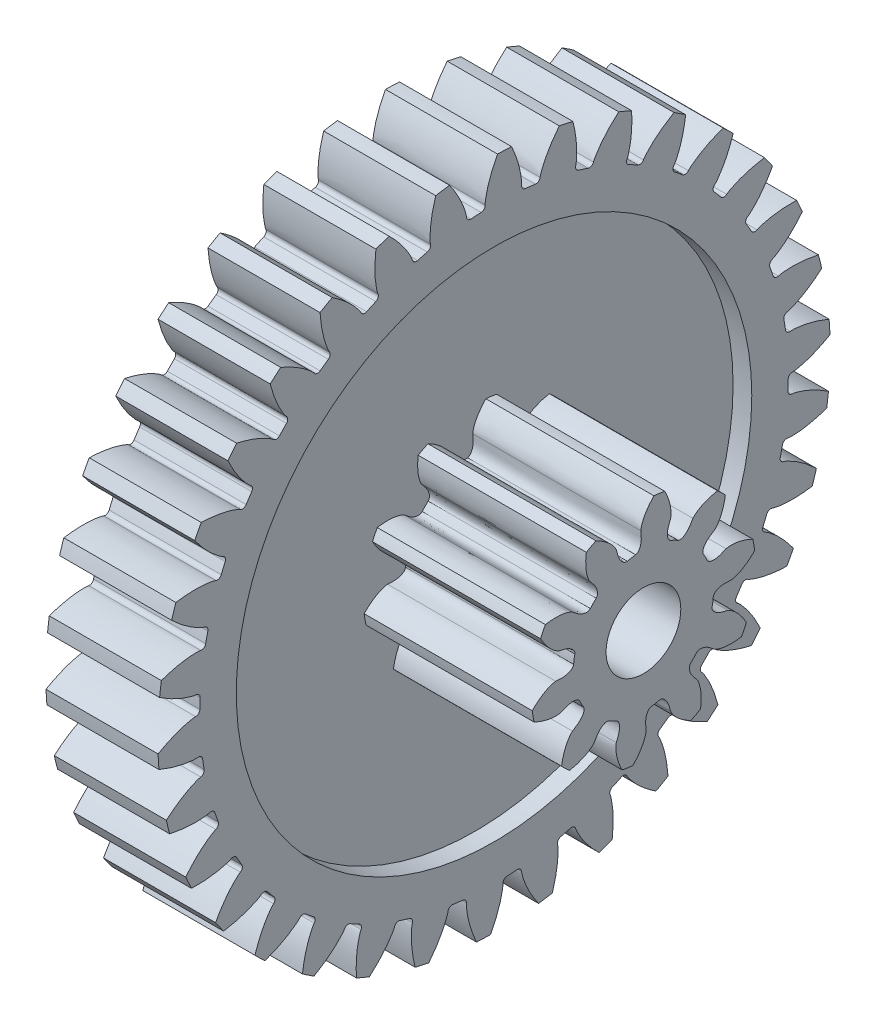
from build123d import *

# Parameters (mm, degrees)
ESQUISSE2_R             = 1
BOSS_EXTRU_1_DEPTH      = 3
ESQUISSE3_R             = 6.9
ENL_V_MAT_EXTRU_1_DEPTH = 0.5
ESQUISSE4_R             = 1
BOSS_EXTRU_2_DEPTH      = 4.5


with BuildPart() as part:
    # Esquisse2 → Boss.-Extru.1 (new body)
    with BuildSketch(Plane(origin=(0, 0, 0), x_dir=(0, 0, -1), z_dir=(1, 0, 0))):
        with BuildLine():
            ThreePointArc((8.992678526, 0.362950305), (8.983203595, 0.549593642), (8.969855294, 0.736000007))
            add(Edge.make_bspline(
                [(7.928017131, 0.973718567), (7.968735547, 0.978720051), (8.14599471, 0.972060465), (8.43210917, 0.923262044), (8.735368899, 0.829543111), (8.90576586, 0.762906571), (8.969855294, 0.736000007)],
                knots=[0, 0, 0, 0, 0.124841327, 0.52877899, 0.867841808, 1.076016146, 1.076016146, 1.076016146, 1.076016146], degree=3))
            ThreePointArc((7.928017131, 0.973718567), (7.845145349, 0.995861242), (7.801971612, 1.069983161))
            ThreePointArc((7.801971612, 1.069983161), (7.782401197, 1.204099918), (7.760525474, 1.337859996))
            ThreePointArc((7.760525474, 1.337859996), (7.7791127, 1.421320515), (7.851006147, 1.467607399))
            add(Edge.make_bspline(
                [(7.851006147, 1.467607399), (7.891911369, 1.47525391), (8.058869705, 1.535171146), (8.316858832, 1.668153777), (8.577616241, 1.849137964), (8.719907754, 1.964153953), (8.772869142, 2.009170729)],
                knots=[0, 0, 0, 0, 0.124841327, 0.52877899, 0.867841808, 1.076016146, 1.076016146, 1.076016146, 1.076016146], degree=3))
            ThreePointArc((8.772869142, 2.009170729), (8.729259916, 2.190895095), (8.681886815, 2.371674793))
            add(Edge.make_bspline(
                [(7.614107256, 2.413908484), (7.653213344, 2.426306797), (7.828678029, 2.452331888), (8.118887532, 2.456937748), (8.434204497, 2.420538386), (8.613944558, 2.38634682), (8.681886815, 2.371674793)],
                knots=[0, 0, 0, 0, 0.124841327, 0.52877899, 0.867841808, 1.076016146, 1.076016146, 1.076016146, 1.076016146], degree=3))
            ThreePointArc((7.614107256, 2.413908484), (7.528577818, 2.420446487), (7.472519329, 2.485373186))
            ThreePointArc((7.472519329, 2.485373186), (7.428638248, 2.613610296), (7.382556651, 2.741073201))
            ThreePointArc((7.382556651, 2.741073201), (7.385491564, 2.82652804), (7.447655696, 2.885237188))
            add(Edge.make_bspline(
                [(7.447655696, 2.885237188), (7.486459386, 2.900269817), (7.639565176, 2.989845363), (7.868726054, 3.167969089), (8.091787815, 3.393785724), (8.210522412, 3.532989345), (8.254310221, 3.586971254)],
                knots=[0, 0, 0, 0, 0.124841327, 0.52877899, 0.867841808, 1.076016146, 1.076016146, 1.076016146, 1.076016146], degree=3))
            ThreePointArc((8.254310221, 3.586971254), (8.17805176, 3.757588243), (8.098267094, 3.926585039))
            add(Edge.make_bspline(
                [(7.040908091, 3.771895641), (7.077070139, 3.791268575), (7.244765106, 3.849092091), (7.529186917, 3.906945383), (7.845823377, 3.92910513), (8.028785705, 3.928522889), (8.098267094, 3.926585039)],
                knots=[0, 0, 0, 0, 0.124841327, 0.52877899, 0.867841808, 1.076016146, 1.076016146, 1.076016146, 1.076016146], degree=3))
            ThreePointArc((7.040908091, 3.771895641), (6.955633599, 3.76260633), (6.888599363, 3.816126808))
            ThreePointArc((6.888599363, 3.816126808), (6.821901934, 3.93411731), (6.753183716, 4.050942446))
            ThreePointArc((6.753183716, 4.050942446), (6.740366371, 4.135481543), (6.790684263, 4.204613685))
            add(Edge.make_bspline(
                [(6.790684263, 4.204613685), (6.826065008, 4.226520515), (6.960104418, 4.342703981), (7.152633247, 4.559903013), (7.33040326, 4.822862182), (7.421537577, 4.981513022), (7.454660665, 5.042621775)],
                knots=[0, 0, 0, 0, 0.124841327, 0.52877899, 0.867841808, 1.076016146, 1.076016146, 1.076016146, 1.076016146], degree=3))
            ThreePointArc((7.454660665, 5.042621775), (7.34834986, 5.19632123), (7.2388706, 5.34778014))
            add(Edge.make_bspline(
                [(6.227939246, 5.001435417), (6.259925799, 5.027123248), (6.414140397, 5.114776078), (6.683088872, 5.223906679), (6.990262151, 5.303870911), (7.170216185, 5.336917824), (7.2388706, 5.34778014)],
                knots=[0, 0, 0, 0, 0.124841327, 0.52877899, 0.867841808, 1.076016146, 1.076016146, 1.076016146, 1.076016146], degree=3))
            ThreePointArc((6.227939246, 5.001435417), (6.14582362, 4.976635127), (6.070096408, 5.016926809))
            ThreePointArc((6.070096408, 5.016926809), (5.982853931, 5.120652678), (5.893839209, 5.222861704))
            ThreePointArc((5.893839209, 5.222861704), (5.865706085, 5.303606182), (5.902464222, 5.380807106))
            add(Edge.make_bspline(
                [(5.902464222, 5.380807106), (5.933217173, 5.408842125), (6.043625651, 5.547677024), (6.192966094, 5.79655491), (6.319390614, 6.087701853), (6.379821181, 6.260397247), (6.401151581, 6.32655186)],
                knots=[0, 0, 0, 0, 0.124841327, 0.52877899, 0.867841808, 1.076016146, 1.076016146, 1.076016146, 1.076016146], degree=3))
            ThreePointArc((6.401151581, 6.32655186), (6.268408719, 6.45809973), (6.13296305, 6.586863003))
            add(Edge.make_bspline(
                [(5.202885399, 6.060657308), (5.229607193, 6.091785269), (5.36508983, 6.206282501), (5.60940625, 6.362974098), (5.896655932, 6.498019729), (6.067473552, 6.563570423), (6.13296305, 6.586863003)],
                knots=[0, 0, 0, 0, 0.124841327, 0.52877899, 0.867841808, 1.076016146, 1.076016146, 1.076016146, 1.076016146], degree=3))
            ThreePointArc((5.202885399, 6.060657308), (5.126724989, 6.021190583), (5.044883599, 6.046881384))
            ThreePointArc((5.044883599, 6.046881384), (4.940067013, 6.13281036), (4.833787077, 6.216922671))
            ThreePointArc((4.833787077, 6.216922671), (4.791296214, 6.291122873), (4.813242841, 6.373763594))
            add(Edge.make_bspline(
                [(4.813242841, 6.373763594), (4.838320743, 6.406972104), (4.921338461, 6.563730579), (5.022404908, 6.835812081), (5.0931787, 7.145232139), (5.120847626, 7.326091153), (5.129658958, 7.395038808)],
                knots=[0, 0, 0, 0, 0.124841327, 0.52877899, 0.867841808, 1.076016146, 1.076016146, 1.076016146, 1.076016146], degree=3))
            ThreePointArc((5.129658958, 7.395038808), (4.975004437, 7.49995539), (4.818204799, 7.601638147))
            add(Edge.make_bspline(
                [(4.00065353, 6.913490784), (4.021200587, 6.948998848), (4.133337563, 7.086441417), (4.344702027, 7.285358066), (4.602246167, 7.470886279), (4.758110384, 7.566708503), (4.818204799, 7.601638147)],
                knots=[0, 0, 0, 0, 0.124841327, 0.52877899, 0.867841808, 1.076016146, 1.076016146, 1.076016146, 1.076016146], degree=3))
            ThreePointArc((4.00065353, 6.913490784), (3.933041887, 6.860701616), (3.84787333, 6.870916666))
            ThreePointArc((3.84787333, 6.870916666), (3.729052038, 6.936122541), (3.609126123, 6.999273793))
            ThreePointArc((3.609126123, 6.999273793), (3.553724497, 7.06440292), (3.560112248, 7.149669208))
            add(Edge.make_bspline(
                [(3.560112248, 7.149669208), (3.578661103, 7.186920332), (3.631460993, 7.356264162), (3.680811746, 7.64228387), (3.693524693, 7.959440113), (3.687489747, 8.142303811), (3.683481951, 8.21169658)],
                knots=[0, 0, 0, 0, 0.124841327, 0.52877899, 0.867841808, 1.076016146, 1.076016146, 1.076016146, 1.076016146], degree=3))
            ThreePointArc((3.683481951, 8.21169658), (3.512182346, 8.286409063), (3.339368362, 8.35754862))
            add(Edge.make_bspline(
                [(2.662184203, 7.530893622), (2.675856818, 7.569572607), (2.760829443, 7.72528007), (2.932044187, 7.959647903), (3.151112429, 8.189340757), (3.286715474, 8.3121714), (3.339368362, 8.35754862)],
                knots=[0, 0, 0, 0, 0.124841327, 0.52877899, 0.867841808, 1.076016146, 1.076016146, 1.076016146, 1.076016146], degree=3))
            ThreePointArc((2.662184203, 7.530893622), (2.605423761, 7.466579684), (2.51982835, 7.460971122))
            ThreePointArc((2.51982835, 7.460971122), (2.391048668, 7.503233388), (2.261560708, 7.543273041))
            ThreePointArc((2.261560708, 7.543273041), (2.195134954, 7.597113198), (2.185746302, 7.682101412))
            add(Edge.make_bspline(
                [(2.185746302, 7.682101412), (2.197134452, 7.722126608), (2.217918476, 7.898288992), (2.213872956, 8.188506848), (2.168092134, 8.502598901), (2.128558827, 8.681240079), (2.111868384, 8.748714873)],
                knots=[0, 0, 0, 0, 0.124841327, 0.52877899, 0.867841808, 1.076016146, 1.076016146, 1.076016146, 1.076016146], degree=3))
            ThreePointArc((2.111868384, 8.748714873), (1.929757098, 8.790679015), (1.74681374, 8.8288528))
            add(Edge.make_bspline(
                [(1.233057386, 7.891840911), (1.239389954, 7.932373648), (1.294304588, 8.101043575), (1.419539098, 8.362881478), (1.592671336, 8.628917058), (1.70339541, 8.77457327), (1.74681374, 8.8288528)],
                knots=[0, 0, 0, 0, 0.124841327, 0.52877899, 0.867841808, 1.076016146, 1.076016146, 1.076016146, 1.076016146], degree=3))
            ThreePointArc((1.233057386, 7.891840911), (1.189081054, 7.818192336), (1.105973638, 7.796951155))
            ThreePointArc((1.105973638, 7.796951155), (0.971621004, 7.81483062), (0.836980555, 7.830395172))
            ThreePointArc((0.836980555, 7.830395172), (0.761792723, 7.871112898), (0.736947387, 7.952928866))
            add(Edge.make_bspline(
                [(0.736947387, 7.952928866), (0.740787022, 7.994365125), (0.728847405, 8.171347063), (0.671543377, 8.455880046), (0.568827797, 8.756211882), (0.49714239, 8.924547128), (0.468337672, 8.987806174)],
                knots=[0, 0, 0, 0, 0.124841327, 0.52877899, 0.867841808, 1.076016146, 1.076016146, 1.076016146, 1.076016146], degree=3))
            ThreePointArc((0.468337672, 8.987806174), (0.281616286, 8.995592936), (0.094773472, 8.999500986))
            add(Edge.make_bspline(
                [(-0.238059721, 7.984041022), (-0.239282848, 8.02504722), (-0.216296258, 8.200935757), (-0.141306691, 8.481327153), (-0.020006268, 8.774645937), (0.062068259, 8.938167571), (0.094773472, 8.999500986)],
                knots=[0, 0, 0, 0, 0.124841327, 0.52877899, 0.867841808, 1.076016146, 1.076016146, 1.076016146, 1.076016146], degree=3))
            ThreePointArc((-0.238059721, 7.984041022), (-0.267754383, 7.903565825), (-0.34554368, 7.867415368))
            ThreePointArc((-0.34554368, 7.867415368), (-0.480894049, 7.860303169), (-0.616101967, 7.850862587))
            ThreePointArc((-0.616101967, 7.850862587), (-0.697491446, 7.877071289), (-0.736947387, 7.952928866))
            add(Edge.make_bspline(
                [(-0.736947387, 7.952928866), (-0.740787022, 7.994365125), (-0.78504369, 8.166139711), (-0.893654807, 8.435298391), (-1.049807289, 8.711642568), (-1.151203635, 8.863939428), (-1.191141718, 8.920828516)],
                knots=[0, 0, 0, 0, 0.124841327, 0.52877899, 0.867841808, 1.076016146, 1.076016146, 1.076016146, 1.076016146], degree=3))
            ThreePointArc((-1.191141718, 8.920828516), (-1.376114631, 8.894172728), (-1.560494193, 8.863681959))
            add(Edge.make_bspline(
                [(-1.70106999, 7.804354193), (-1.70980716, 7.844437433), (-1.719531394, 8.021554909), (-1.697340451, 8.310951405), (-1.632002584, 8.621564774), (-1.581372552, 8.797383295), (-1.560494193, 8.863681959)],
                knots=[0, 0, 0, 0, 0.124841327, 0.52877899, 0.867841808, 1.076016146, 1.076016146, 1.076016146, 1.076016146], degree=3))
            ThreePointArc((-1.70106999, 7.804354193), (-1.715471765, 7.719792859), (-1.785293922, 7.669964186))
            ThreePointArc((-1.785293922, 7.669964186), (-1.917032831, 7.638102521), (-2.048203875, 7.603978293))
            ThreePointArc((-2.048203875, 7.603978293), (-2.13302338, 7.614785465), (-2.185746302, 7.682101412))
            add(Edge.make_bspline(
                [(-2.185746302, 7.682101412), (-2.197134452, 7.722126608), (-2.272201064, 7.882844264), (-2.428420647, 8.127462766), (-2.632692446, 8.370408715), (-2.760346802, 8.501480902), (-2.810058205, 8.550062742)],
                knots=[0, 0, 0, 0, 0.124841327, 0.52877899, 0.867841808, 1.076016146, 1.076016146, 1.076016146, 1.076016146], degree=3))
            ThreePointArc((-2.810058205, 8.550062742), (-2.986983615, 8.489872136), (-3.1626211, 8.426020875))
            add(Edge.make_bspline(
                [(-3.106152361, 7.358899441), (-3.12210604, 7.396694737), (-3.164209951, 7.569009628), (-3.195573318, 7.857556174), (-3.188423008, 8.174886562), (-3.170961618, 8.357014683), (-3.1626211, 8.426020875)],
                knots=[0, 0, 0, 0, 0.124841327, 0.52877899, 0.867841808, 1.076016146, 1.076016146, 1.076016146, 1.076016146], degree=3))
            ThreePointArc((-3.106152361, 7.358899441), (-3.104770813, 7.273131606), (-3.164248122, 7.211321573))
            ThreePointArc((-3.164248122, 7.211321573), (-3.287889359, 7.155795453), (-3.410556657, 7.098149639))
            ThreePointArc((-3.410556657, 7.098149639), (-3.49591776, 7.093187254), (-3.560112248, 7.149669208))
            add(Edge.make_bspline(
                [(-3.560112248, 7.149669208), (-3.578661103, 7.186920332), (-3.681981355, 7.331108011), (-3.880489536, 7.542856145), (-4.125924419, 7.744130633), (-4.275489668, 7.84951464), (-4.33328153, 7.888134836)],
                knots=[0, 0, 0, 0, 0.124841327, 0.52877899, 0.867841808, 1.076016146, 1.076016146, 1.076016146, 1.076016146], degree=3))
            ThreePointArc((-4.33328153, 7.888134836), (-4.496134454, 7.79645913), (-4.657048739, 7.701421755))
            add(Edge.make_bspline(
                [(-4.405458438, 6.662846196), (-4.428085343, 6.697066474), (-4.501135134, 6.858710803), (-4.584984768, 7.136581292), (-4.636265512, 7.449822393), (-4.652567389, 7.632057959), (-4.657048739, 7.701421755)],
                knots=[0, 0, 0, 0, 0.124841327, 0.52877899, 0.867841808, 1.076016146, 1.076016146, 1.076016146, 1.076016146], degree=3))
            ThreePointArc((-4.405458438, 6.662846196), (-4.388340616, 6.578792579), (-4.435447646, 6.507106053))
            ThreePointArc((-4.435447646, 6.507106053), (-4.546780759, 6.429806352), (-4.656767022, 6.350602011))
            ThreePointArc((-4.656767022, 6.350602011), (-4.739762855, 6.330039059), (-4.813242841, 6.373763594))
            add(Edge.make_bspline(
                [(-4.813242841, 6.373763594), (-4.838320743, 6.406972104), (-4.966376188, 6.529719667), (-5.200413007, 6.701386604), (-5.478652985, 6.85413547), (-5.645035862, 6.930242572), (-5.70894015, 6.957585958)],
                knots=[0, 0, 0, 0, 0.124841327, 0.52877899, 0.867841808, 1.076016146, 1.076016146, 1.076016146, 1.076016146], degree=3))
            ThreePointArc((-5.70894015, 6.957585958), (-5.852174827, 6.83754706), (-5.992886168, 6.714559954))
            add(Edge.make_bspline(
                [(-5.554741912, 5.739897714), (-5.58327151, 5.769377644), (-5.684779557, 5.914846807), (-5.81826006, 6.172578694), (-5.926225553, 6.471063457), (-5.975735558, 6.647200654), (-5.992886168, 6.714559954)],
                knots=[0, 0, 0, 0, 0.124841327, 0.52877899, 0.867841808, 1.076016146, 1.076016146, 1.076016146, 1.076016146], degree=3))
            ThreePointArc((-5.554741912, 5.739897714), (-5.522470742, 5.660420661), (-5.555603321, 5.58129884))
            ThreePointArc((-5.555603321, 5.58129884), (-5.650836993, 5.484857908), (-5.744396771, 5.386792249))
            ThreePointArc((-5.744396771, 5.386792249), (-5.82220101, 5.351328976), (-5.902464222, 5.380807106))
            add(Edge.make_bspline(
                [(-5.902464222, 5.380807106), (-5.933217173, 5.408842125), (-6.081647036, 5.505969552), (-6.34324265, 5.63170938), (-6.644812595, 5.730730945), (-6.82234713, 5.774969405), (-6.89018766, 5.790104836)],
                knots=[0, 0, 0, 0, 0.124841327, 0.52877899, 0.867841808, 1.076016146, 1.076016146, 1.076016146, 1.076016146], degree=3))
            ThreePointArc((-6.89018766, 5.790104836), (-7.008926405, 5.645790525), (-7.124643046, 5.499041868))
            add(Edge.make_bspline(
                [(-6.514865313, 4.6214839), (-6.548326063, 4.645219578), (-6.674835631, 4.769559798), (-6.853401485, 4.998376331), (-7.014375092, 5.271940217), (-7.095407219, 5.435980904), (-7.124643046, 5.499041868)],
                knots=[0, 0, 0, 0, 0.124841327, 0.52877899, 0.867841808, 1.076016146, 1.076016146, 1.076016146, 1.076016146], degree=3))
            ThreePointArc((-6.514865313, 4.6214839), (-6.46853975, 4.549289907), (-6.486569587, 4.46542719))
            ThreePointArc((-6.486569587, 4.46542719), (-6.562460751, 4.353129207), (-6.636407979, 4.239541737))
            ThreePointArc((-6.636407979, 4.239541737), (-6.706371093, 4.190385802), (-6.790684263, 4.204613685))
            add(Edge.make_bspline(
                [(-6.790684263, 4.204613685), (-6.826065008, 4.226520515), (-6.989814688, 4.294720246), (-7.270060773, 4.370251048), (-7.584691081, 4.41217325), (-7.767331549, 4.423036581), (-7.836798093, 4.425448638)],
                knots=[0, 0, 0, 0, 0.124841327, 0.52877899, 0.867841808, 1.076016146, 1.076016146, 1.076016146, 1.076016146], degree=3))
            ThreePointArc((-7.836798093, 4.425448638), (-7.9269974, 4.261773366), (-8.013778751, 4.096260505))
            add(Edge.make_bspline(
                [(-7.253132789, 3.345690994), (-7.290385226, 3.362874131), (-7.437588183, 3.46185115), (-7.655158542, 3.653960257), (-7.863658499, 3.893287376), (-7.973453297, 4.039645344), (-8.013778751, 4.096260505)],
                knots=[0, 0, 0, 0, 0.124841327, 0.52877899, 0.867841808, 1.076016146, 1.076016146, 1.076016146, 1.076016146], degree=3))
            ThreePointArc((-7.253132789, 3.345690994), (-7.194330395, 3.283238541), (-7.196643507, 3.197490772))
            ThreePointArc((-7.196643507, 3.197490772), (-7.250607779, 3.073159911), (-7.302424271, 2.947918717))
            ThreePointArc((-7.302424271, 2.947918717), (-7.362163751, 2.886744066), (-7.447655696, 2.885237188))
            add(Edge.make_bspline(
                [(-7.447655696, 2.885237188), (-7.486459386, 2.900269817), (-7.659952585, 2.937219394), (-7.949305695, 2.959969057), (-8.266282009, 2.943364287), (-8.447808808, 2.920482551), (-8.516535767, 2.910089094)],
                knots=[0, 0, 0, 0, 0.124841327, 0.52877899, 0.867841808, 1.076016146, 1.076016146, 1.076016146, 1.076016146], degree=3))
            ThreePointArc((-8.516535767, 2.910089094), (-8.575124006, 2.732626625), (-8.630014832, 2.553985905))
            add(Edge.make_bspline(
                [(-7.744403527, 1.955964595), (-7.784179063, 1.966010038), (-7.94706259, 2.036253313), (-8.196228356, 2.185112949), (-8.445154448, 2.382053302), (-8.579972987, 2.505744507), (-8.630014832, 2.553985905)],
                knots=[0, 0, 0, 0, 0.124841327, 0.52877899, 0.867841808, 1.076016146, 1.076016146, 1.076016146, 1.076016146], degree=3))
            ThreePointArc((-7.744403527, 1.955964595), (-7.675126748, 1.905380425), (-7.661644363, 1.820667641))
            ThreePointArc((-7.661644363, 1.820667641), (-7.691844055, 1.68853784), (-7.719765264, 1.55590786))
            ThreePointArc((-7.719765264, 1.55590786), (-7.767246753, 1.484797724), (-7.851006147, 1.467607399))
            add(Edge.make_bspline(
                [(-7.851006147, 1.467607399), (-7.891911369, 1.47525391), (-8.069239983, 1.479695059), (-8.357846547, 1.448888871), (-8.666374618, 1.374322583), (-8.84060607, 1.318474991), (-8.906253029, 1.295629957)],
                knots=[0, 0, 0, 0, 0.124841327, 0.52877899, 0.867841808, 1.076016146, 1.076016146, 1.076016146, 1.076016146], degree=3))
            ThreePointArc((-8.906253029, 1.295629957), (-8.93123505, 1.110423563), (-8.952366108, 0.924738377))
            add(Edge.make_bspline(
                [(-7.971947891, 0.499630167), (-8.012892019, 0.502195832), (-8.185909312, 0.541313312), (-8.458185443, 0.641854241), (-8.73906079, 0.78970126), (-8.894311987, 0.886513545), (-8.952366108, 0.924738377)],
                knots=[0, 0, 0, 0, 0.124841327, 0.52877899, 0.867841808, 1.076016146, 1.076016146, 1.076016146, 1.076016146], degree=3))
            ThreePointArc((-7.971947891, 0.499630167), (-7.894555864, 0.462636863), (-7.865737109, 0.381843858))
            ThreePointArc((-7.865737109, 0.381843858), (-7.871143807, 0.246414639), (-7.874218909, 0.110912427))
            ThreePointArc((-7.874218909, 0.110912427), (-7.907825483, 0.032288375), (-7.987, 0))
            add(Edge.make_bspline(
                [(-7.987, 0), (-8.028613776, 0), (-8.203739092, -0.028218518), (-8.481770958, -0.111531489), (-8.771344233, -0.241520028), (-8.932347096, -0.328431654), (-8.992678526, -0.362950305)],
                knots=[0, 0, 0, 0, 0.124841327, 0.52877899, 0.867841808, 1.076016146, 1.076016146, 1.076016146, 1.076016146], degree=3))
            ThreePointArc((-8.992678526, -0.362950305), (-8.983203595, -0.549593642), (-8.969855294, -0.736000007))
            add(Edge.make_bspline(
                [(-7.928017131, -0.973718567), (-7.968735547, -0.978720051), (-8.14599471, -0.972060465), (-8.43210917, -0.923262044), (-8.735368899, -0.829543111), (-8.90576586, -0.762906571), (-8.969855294, -0.736000007)],
                knots=[0, 0, 0, 0, 0.124841327, 0.52877899, 0.867841808, 1.076016146, 1.076016146, 1.076016146, 1.076016146], degree=3))
            ThreePointArc((-7.928017131, -0.973718567), (-7.845145349, -0.995861242), (-7.801971612, -1.069983161))
            ThreePointArc((-7.801971612, -1.069983161), (-7.782401197, -1.204099918), (-7.760525474, -1.337859996))
            ThreePointArc((-7.760525474, -1.337859996), (-7.7791127, -1.421320515), (-7.851006147, -1.467607399))
            add(Edge.make_bspline(
                [(-7.851006147, -1.467607399), (-7.891911369, -1.47525391), (-8.058869705, -1.535171146), (-8.316858832, -1.668153777), (-8.577616241, -1.849137964), (-8.719907754, -1.964153953), (-8.772869142, -2.009170729)],
                knots=[0, 0, 0, 0, 0.124841327, 0.52877899, 0.867841808, 1.076016146, 1.076016146, 1.076016146, 1.076016146], degree=3))
            ThreePointArc((-8.772869142, -2.009170729), (-8.729259916, -2.190895095), (-8.681886815, -2.371674793))
            add(Edge.make_bspline(
                [(-7.614107256, -2.413908484), (-7.653213344, -2.426306797), (-7.828678029, -2.452331888), (-8.118887532, -2.456937748), (-8.434204497, -2.420538386), (-8.613944558, -2.38634682), (-8.681886815, -2.371674793)],
                knots=[0, 0, 0, 0, 0.124841327, 0.52877899, 0.867841808, 1.076016146, 1.076016146, 1.076016146, 1.076016146], degree=3))
            ThreePointArc((-7.614107256, -2.413908484), (-7.528577818, -2.420446487), (-7.472519329, -2.485373186))
            ThreePointArc((-7.472519329, -2.485373186), (-7.428638248, -2.613610296), (-7.382556651, -2.741073201))
            ThreePointArc((-7.382556651, -2.741073201), (-7.385491564, -2.82652804), (-7.447655696, -2.885237188))
            add(Edge.make_bspline(
                [(-7.447655696, -2.885237188), (-7.486459386, -2.900269817), (-7.639565176, -2.989845363), (-7.868726054, -3.167969089), (-8.091787815, -3.393785724), (-8.210522412, -3.532989345), (-8.254310221, -3.586971254)],
                knots=[0, 0, 0, 0, 0.124841327, 0.52877899, 0.867841808, 1.076016146, 1.076016146, 1.076016146, 1.076016146], degree=3))
            ThreePointArc((-8.254310221, -3.586971254), (-8.17805176, -3.757588243), (-8.098267094, -3.926585039))
            add(Edge.make_bspline(
                [(-7.040908091, -3.771895641), (-7.077070139, -3.791268575), (-7.244765106, -3.849092091), (-7.529186917, -3.906945383), (-7.845823377, -3.92910513), (-8.028785705, -3.928522889), (-8.098267094, -3.926585039)],
                knots=[0, 0, 0, 0, 0.124841327, 0.52877899, 0.867841808, 1.076016146, 1.076016146, 1.076016146, 1.076016146], degree=3))
            ThreePointArc((-7.040908091, -3.771895641), (-6.955633599, -3.76260633), (-6.888599363, -3.816126808))
            ThreePointArc((-6.888599363, -3.816126808), (-6.821901934, -3.93411731), (-6.753183716, -4.050942446))
            ThreePointArc((-6.753183716, -4.050942446), (-6.740366371, -4.135481543), (-6.790684263, -4.204613685))
            add(Edge.make_bspline(
                [(-6.790684263, -4.204613685), (-6.826065008, -4.226520515), (-6.960104418, -4.342703981), (-7.152633247, -4.559903013), (-7.33040326, -4.822862182), (-7.421537577, -4.981513022), (-7.454660665, -5.042621775)],
                knots=[0, 0, 0, 0, 0.124841327, 0.52877899, 0.867841808, 1.076016146, 1.076016146, 1.076016146, 1.076016146], degree=3))
            ThreePointArc((-7.454660665, -5.042621775), (-7.34834986, -5.19632123), (-7.2388706, -5.34778014))
            add(Edge.make_bspline(
                [(-6.227939246, -5.001435417), (-6.259925799, -5.027123248), (-6.414140397, -5.114776078), (-6.683088872, -5.223906679), (-6.990262151, -5.303870911), (-7.170216185, -5.336917824), (-7.2388706, -5.34778014)],
                knots=[0, 0, 0, 0, 0.124841327, 0.52877899, 0.867841808, 1.076016146, 1.076016146, 1.076016146, 1.076016146], degree=3))
            ThreePointArc((-6.227939246, -5.001435417), (-6.14582362, -4.976635127), (-6.070096408, -5.016926809))
            ThreePointArc((-6.070096408, -5.016926809), (-5.982853931, -5.120652678), (-5.893839209, -5.222861704))
            ThreePointArc((-5.893839209, -5.222861704), (-5.865706085, -5.303606182), (-5.902464222, -5.380807106))
            add(Edge.make_bspline(
                [(-5.902464222, -5.380807106), (-5.933217173, -5.408842125), (-6.043625651, -5.547677024), (-6.192966094, -5.79655491), (-6.319390614, -6.087701853), (-6.379821181, -6.260397247), (-6.401151581, -6.32655186)],
                knots=[0, 0, 0, 0, 0.124841327, 0.52877899, 0.867841808, 1.076016146, 1.076016146, 1.076016146, 1.076016146], degree=3))
            ThreePointArc((-6.401151581, -6.32655186), (-6.268408719, -6.45809973), (-6.13296305, -6.586863003))
            add(Edge.make_bspline(
                [(-5.202885399, -6.060657308), (-5.229607193, -6.091785269), (-5.36508983, -6.206282501), (-5.60940625, -6.362974098), (-5.896655932, -6.498019729), (-6.067473552, -6.563570423), (-6.13296305, -6.586863003)],
                knots=[0, 0, 0, 0, 0.124841327, 0.52877899, 0.867841808, 1.076016146, 1.076016146, 1.076016146, 1.076016146], degree=3))
            ThreePointArc((-5.202885399, -6.060657308), (-5.126724989, -6.021190583), (-5.044883599, -6.046881384))
            ThreePointArc((-5.044883599, -6.046881384), (-4.940067013, -6.13281036), (-4.833787077, -6.216922671))
            ThreePointArc((-4.833787077, -6.216922671), (-4.791296214, -6.291122873), (-4.813242841, -6.373763594))
            add(Edge.make_bspline(
                [(-4.813242841, -6.373763594), (-4.838320743, -6.406972104), (-4.921338461, -6.563730579), (-5.022404908, -6.835812081), (-5.0931787, -7.145232139), (-5.120847626, -7.326091153), (-5.129658958, -7.395038808)],
                knots=[0, 0, 0, 0, 0.124841327, 0.52877899, 0.867841808, 1.076016146, 1.076016146, 1.076016146, 1.076016146], degree=3))
            ThreePointArc((-5.129658958, -7.395038808), (-4.975004437, -7.49995539), (-4.818204799, -7.601638147))
            add(Edge.make_bspline(
                [(-4.00065353, -6.913490784), (-4.021200587, -6.948998848), (-4.133337563, -7.086441417), (-4.344702027, -7.285358066), (-4.602246167, -7.470886279), (-4.758110384, -7.566708503), (-4.818204799, -7.601638147)],
                knots=[0, 0, 0, 0, 0.124841327, 0.52877899, 0.867841808, 1.076016146, 1.076016146, 1.076016146, 1.076016146], degree=3))
            ThreePointArc((-4.00065353, -6.913490784), (-3.933041887, -6.860701616), (-3.84787333, -6.870916666))
            ThreePointArc((-3.84787333, -6.870916666), (-3.729052038, -6.936122541), (-3.609126123, -6.999273793))
            ThreePointArc((-3.609126123, -6.999273793), (-3.553724497, -7.06440292), (-3.560112248, -7.149669208))
            add(Edge.make_bspline(
                [(-3.560112248, -7.149669208), (-3.578661103, -7.186920332), (-3.631460993, -7.356264162), (-3.680811746, -7.64228387), (-3.693524693, -7.959440113), (-3.687489747, -8.142303811), (-3.683481951, -8.21169658)],
                knots=[0, 0, 0, 0, 0.124841327, 0.52877899, 0.867841808, 1.076016146, 1.076016146, 1.076016146, 1.076016146], degree=3))
            ThreePointArc((-3.683481951, -8.21169658), (-3.512182346, -8.286409063), (-3.339368362, -8.35754862))
            add(Edge.make_bspline(
                [(-2.662184203, -7.530893622), (-2.675856818, -7.569572607), (-2.760829443, -7.72528007), (-2.932044187, -7.959647903), (-3.151112429, -8.189340757), (-3.286715474, -8.3121714), (-3.339368362, -8.35754862)],
                knots=[0, 0, 0, 0, 0.124841327, 0.52877899, 0.867841808, 1.076016146, 1.076016146, 1.076016146, 1.076016146], degree=3))
            ThreePointArc((-2.662184203, -7.530893622), (-2.605423761, -7.466579684), (-2.51982835, -7.460971122))
            ThreePointArc((-2.51982835, -7.460971122), (-2.391048668, -7.503233388), (-2.261560708, -7.543273041))
            ThreePointArc((-2.261560708, -7.543273041), (-2.195134954, -7.597113198), (-2.185746302, -7.682101412))
            add(Edge.make_bspline(
                [(-2.185746302, -7.682101412), (-2.197134452, -7.722126608), (-2.217918476, -7.898288992), (-2.213872956, -8.188506848), (-2.168092134, -8.502598901), (-2.128558827, -8.681240079), (-2.111868384, -8.748714873)],
                knots=[0, 0, 0, 0, 0.124841327, 0.52877899, 0.867841808, 1.076016146, 1.076016146, 1.076016146, 1.076016146], degree=3))
            ThreePointArc((-2.111868384, -8.748714873), (-1.929757098, -8.790679015), (-1.74681374, -8.8288528))
            add(Edge.make_bspline(
                [(-1.233057386, -7.891840911), (-1.239389954, -7.932373648), (-1.294304588, -8.101043575), (-1.419539098, -8.362881478), (-1.592671336, -8.628917058), (-1.70339541, -8.77457327), (-1.74681374, -8.8288528)],
                knots=[0, 0, 0, 0, 0.124841327, 0.52877899, 0.867841808, 1.076016146, 1.076016146, 1.076016146, 1.076016146], degree=3))
            ThreePointArc((-1.233057386, -7.891840911), (-1.189081054, -7.818192336), (-1.105973638, -7.796951155))
            ThreePointArc((-1.105973638, -7.796951155), (-0.971621004, -7.81483062), (-0.836980555, -7.830395172))
            ThreePointArc((-0.836980555, -7.830395172), (-0.761792723, -7.871112898), (-0.736947387, -7.952928866))
            add(Edge.make_bspline(
                [(-0.736947387, -7.952928866), (-0.740787022, -7.994365125), (-0.728847405, -8.171347063), (-0.671543377, -8.455880046), (-0.568827797, -8.756211882), (-0.49714239, -8.924547128), (-0.468337672, -8.987806174)],
                knots=[0, 0, 0, 0, 0.124841327, 0.52877899, 0.867841808, 1.076016146, 1.076016146, 1.076016146, 1.076016146], degree=3))
            ThreePointArc((-0.468337672, -8.987806174), (-0.281616286, -8.995592936), (-0.094773472, -8.999500986))
            add(Edge.make_bspline(
                [(0.238059721, -7.984041022), (0.239282848, -8.02504722), (0.216296258, -8.200935757), (0.141306691, -8.481327153), (0.020006268, -8.774645937), (-0.062068259, -8.938167571), (-0.094773472, -8.999500986)],
                knots=[0, 0, 0, 0, 0.124841327, 0.52877899, 0.867841808, 1.076016146, 1.076016146, 1.076016146, 1.076016146], degree=3))
            ThreePointArc((0.238059721, -7.984041022), (0.267754383, -7.903565825), (0.34554368, -7.867415368))
            ThreePointArc((0.34554368, -7.867415368), (0.480894049, -7.860303169), (0.616101967, -7.850862587))
            ThreePointArc((0.616101967, -7.850862587), (0.697491446, -7.877071289), (0.736947387, -7.952928866))
            add(Edge.make_bspline(
                [(0.736947387, -7.952928866), (0.740787022, -7.994365125), (0.78504369, -8.166139711), (0.893654807, -8.435298391), (1.049807289, -8.711642568), (1.151203635, -8.863939428), (1.191141718, -8.920828516)],
                knots=[0, 0, 0, 0, 0.124841327, 0.52877899, 0.867841808, 1.076016146, 1.076016146, 1.076016146, 1.076016146], degree=3))
            ThreePointArc((1.191141718, -8.920828516), (1.376114631, -8.894172728), (1.560494193, -8.863681959))
            add(Edge.make_bspline(
                [(1.70106999, -7.804354193), (1.70980716, -7.844437433), (1.719531394, -8.021554909), (1.697340451, -8.310951405), (1.632002584, -8.621564774), (1.581372552, -8.797383295), (1.560494193, -8.863681959)],
                knots=[0, 0, 0, 0, 0.124841327, 0.52877899, 0.867841808, 1.076016146, 1.076016146, 1.076016146, 1.076016146], degree=3))
            ThreePointArc((1.70106999, -7.804354193), (1.715471765, -7.719792859), (1.785293922, -7.669964186))
            ThreePointArc((1.785293922, -7.669964186), (1.917032831, -7.638102521), (2.048203875, -7.603978293))
            ThreePointArc((2.048203875, -7.603978293), (2.13302338, -7.614785465), (2.185746302, -7.682101412))
            add(Edge.make_bspline(
                [(2.185746302, -7.682101412), (2.197134452, -7.722126608), (2.272201064, -7.882844264), (2.428420647, -8.127462766), (2.632692446, -8.370408715), (2.760346802, -8.501480902), (2.810058205, -8.550062742)],
                knots=[0, 0, 0, 0, 0.124841327, 0.52877899, 0.867841808, 1.076016146, 1.076016146, 1.076016146, 1.076016146], degree=3))
            ThreePointArc((2.810058205, -8.550062742), (2.986983615, -8.489872136), (3.1626211, -8.426020875))
            add(Edge.make_bspline(
                [(3.106152361, -7.358899441), (3.12210604, -7.396694737), (3.164209951, -7.569009628), (3.195573318, -7.857556174), (3.188423008, -8.174886562), (3.170961618, -8.357014683), (3.1626211, -8.426020875)],
                knots=[0, 0, 0, 0, 0.124841327, 0.52877899, 0.867841808, 1.076016146, 1.076016146, 1.076016146, 1.076016146], degree=3))
            ThreePointArc((3.106152361, -7.358899441), (3.104770813, -7.273131606), (3.164248122, -7.211321573))
            ThreePointArc((3.164248122, -7.211321573), (3.287889359, -7.155795453), (3.410556657, -7.098149639))
            ThreePointArc((3.410556657, -7.098149639), (3.49591776, -7.093187254), (3.560112248, -7.149669208))
            add(Edge.make_bspline(
                [(3.560112248, -7.149669208), (3.578661103, -7.186920332), (3.681981355, -7.331108011), (3.880489536, -7.542856145), (4.125924419, -7.744130633), (4.275489668, -7.84951464), (4.33328153, -7.888134836)],
                knots=[0, 0, 0, 0, 0.124841327, 0.52877899, 0.867841808, 1.076016146, 1.076016146, 1.076016146, 1.076016146], degree=3))
            ThreePointArc((4.33328153, -7.888134836), (4.496134454, -7.79645913), (4.657048739, -7.701421755))
            add(Edge.make_bspline(
                [(4.405458438, -6.662846196), (4.428085343, -6.697066474), (4.501135134, -6.858710803), (4.584984768, -7.136581292), (4.636265512, -7.449822393), (4.652567389, -7.632057959), (4.657048739, -7.701421755)],
                knots=[0, 0, 0, 0, 0.124841327, 0.52877899, 0.867841808, 1.076016146, 1.076016146, 1.076016146, 1.076016146], degree=3))
            ThreePointArc((4.405458438, -6.662846196), (4.388340616, -6.578792579), (4.435447646, -6.507106053))
            ThreePointArc((4.435447646, -6.507106053), (4.546780759, -6.429806352), (4.656767022, -6.350602011))
            ThreePointArc((4.656767022, -6.350602011), (4.739762855, -6.330039059), (4.813242841, -6.373763594))
            add(Edge.make_bspline(
                [(4.813242841, -6.373763594), (4.838320743, -6.406972104), (4.966376188, -6.529719667), (5.200413007, -6.701386604), (5.478652985, -6.85413547), (5.645035862, -6.930242572), (5.70894015, -6.957585958)],
                knots=[0, 0, 0, 0, 0.124841327, 0.52877899, 0.867841808, 1.076016146, 1.076016146, 1.076016146, 1.076016146], degree=3))
            ThreePointArc((5.70894015, -6.957585958), (5.852174827, -6.83754706), (5.992886168, -6.714559954))
            add(Edge.make_bspline(
                [(5.554741912, -5.739897714), (5.58327151, -5.769377644), (5.684779557, -5.914846807), (5.81826006, -6.172578694), (5.926225553, -6.471063457), (5.975735558, -6.647200654), (5.992886168, -6.714559954)],
                knots=[0, 0, 0, 0, 0.124841327, 0.52877899, 0.867841808, 1.076016146, 1.076016146, 1.076016146, 1.076016146], degree=3))
            ThreePointArc((5.554741912, -5.739897714), (5.522470742, -5.660420661), (5.555603321, -5.58129884))
            ThreePointArc((5.555603321, -5.58129884), (5.650836993, -5.484857908), (5.744396771, -5.386792249))
            ThreePointArc((5.744396771, -5.386792249), (5.82220101, -5.351328976), (5.902464222, -5.380807106))
            add(Edge.make_bspline(
                [(5.902464222, -5.380807106), (5.933217173, -5.408842125), (6.081647036, -5.505969552), (6.34324265, -5.63170938), (6.644812595, -5.730730945), (6.82234713, -5.774969405), (6.89018766, -5.790104836)],
                knots=[0, 0, 0, 0, 0.124841327, 0.52877899, 0.867841808, 1.076016146, 1.076016146, 1.076016146, 1.076016146], degree=3))
            ThreePointArc((6.89018766, -5.790104836), (7.008926405, -5.645790525), (7.124643046, -5.499041868))
            add(Edge.make_bspline(
                [(6.514865313, -4.6214839), (6.548326063, -4.645219578), (6.674835631, -4.769559798), (6.853401485, -4.998376331), (7.014375092, -5.271940217), (7.095407219, -5.435980904), (7.124643046, -5.499041868)],
                knots=[0, 0, 0, 0, 0.124841327, 0.52877899, 0.867841808, 1.076016146, 1.076016146, 1.076016146, 1.076016146], degree=3))
            ThreePointArc((6.514865313, -4.6214839), (6.46853975, -4.549289907), (6.486569587, -4.46542719))
            ThreePointArc((6.486569587, -4.46542719), (6.562460751, -4.353129207), (6.636407979, -4.239541737))
            ThreePointArc((6.636407979, -4.239541737), (6.706371093, -4.190385802), (6.790684263, -4.204613685))
            add(Edge.make_bspline(
                [(6.790684263, -4.204613685), (6.826065008, -4.226520515), (6.989814688, -4.294720246), (7.270060773, -4.370251048), (7.584691081, -4.41217325), (7.767331549, -4.423036581), (7.836798093, -4.425448638)],
                knots=[0, 0, 0, 0, 0.124841327, 0.52877899, 0.867841808, 1.076016146, 1.076016146, 1.076016146, 1.076016146], degree=3))
            ThreePointArc((7.836798093, -4.425448638), (7.9269974, -4.261773366), (8.013778751, -4.096260505))
            add(Edge.make_bspline(
                [(7.253132789, -3.345690994), (7.290385226, -3.362874131), (7.437588183, -3.46185115), (7.655158542, -3.653960257), (7.863658499, -3.893287376), (7.973453297, -4.039645344), (8.013778751, -4.096260505)],
                knots=[0, 0, 0, 0, 0.124841327, 0.52877899, 0.867841808, 1.076016146, 1.076016146, 1.076016146, 1.076016146], degree=3))
            ThreePointArc((7.253132789, -3.345690994), (7.194330395, -3.283238541), (7.196643507, -3.197490772))
            ThreePointArc((7.196643507, -3.197490772), (7.250607779, -3.073159911), (7.302424271, -2.947918717))
            ThreePointArc((7.302424271, -2.947918717), (7.362163751, -2.886744066), (7.447655696, -2.885237188))
            add(Edge.make_bspline(
                [(7.447655696, -2.885237188), (7.486459386, -2.900269817), (7.659952585, -2.937219394), (7.949305695, -2.959969057), (8.266282009, -2.943364287), (8.447808808, -2.920482551), (8.516535767, -2.910089094)],
                knots=[0, 0, 0, 0, 0.124841327, 0.52877899, 0.867841808, 1.076016146, 1.076016146, 1.076016146, 1.076016146], degree=3))
            ThreePointArc((8.516535767, -2.910089094), (8.575124006, -2.732626625), (8.630014832, -2.553985905))
            add(Edge.make_bspline(
                [(7.744403527, -1.955964595), (7.784179063, -1.966010038), (7.94706259, -2.036253313), (8.196228356, -2.185112949), (8.445154448, -2.382053302), (8.579972987, -2.505744507), (8.630014832, -2.553985905)],
                knots=[0, 0, 0, 0, 0.124841327, 0.52877899, 0.867841808, 1.076016146, 1.076016146, 1.076016146, 1.076016146], degree=3))
            ThreePointArc((7.744403527, -1.955964595), (7.675126748, -1.905380425), (7.661644363, -1.820667641))
            ThreePointArc((7.661644363, -1.820667641), (7.691844055, -1.68853784), (7.719765264, -1.55590786))
            ThreePointArc((7.719765264, -1.55590786), (7.767246753, -1.484797724), (7.851006147, -1.467607399))
            add(Edge.make_bspline(
                [(7.851006147, -1.467607399), (7.891911369, -1.47525391), (8.069239983, -1.479695059), (8.357846547, -1.448888871), (8.666374618, -1.374322583), (8.84060607, -1.318474991), (8.906253029, -1.295629957)],
                knots=[0, 0, 0, 0, 0.124841327, 0.52877899, 0.867841808, 1.076016146, 1.076016146, 1.076016146, 1.076016146], degree=3))
            ThreePointArc((8.906253029, -1.295629957), (8.93123505, -1.110423563), (8.952366108, -0.924738377))
            add(Edge.make_bspline(
                [(7.971947891, -0.499630167), (8.012892019, -0.502195832), (8.185909312, -0.541313312), (8.458185443, -0.641854241), (8.73906079, -0.78970126), (8.894311987, -0.886513545), (8.952366108, -0.924738377)],
                knots=[0, 0, 0, 0, 0.124841327, 0.52877899, 0.867841808, 1.076016146, 1.076016146, 1.076016146, 1.076016146], degree=3))
            ThreePointArc((7.971947891, -0.499630167), (7.894555864, -0.462636863), (7.865737109, -0.381843858))
            ThreePointArc((7.865737109, -0.381843858), (7.871143807, -0.246414639), (7.874218909, -0.110912427))
            ThreePointArc((7.874218909, -0.110912427), (7.907825483, -0.032288375), (7.987, 0))
            add(Edge.make_bspline(
                [(7.987, 0), (8.028613776, 0), (8.203739092, 0.028218518), (8.481770958, 0.111531489), (8.771344233, 0.241520028), (8.932347096, 0.328431654), (8.992678526, 0.362950305)],
                knots=[0, 0, 0, 0, 0.124841327, 0.52877899, 0.867841808, 1.076016146, 1.076016146, 1.076016146, 1.076016146], degree=3))
        make_face()
        Circle(ESQUISSE2_R, mode=Mode.SUBTRACT)
    extrude(amount=BOSS_EXTRU_1_DEPTH)

    # Esquisse3 → Enlèv. mat.-Extru.1 (cut)
    with BuildSketch(Plane(origin=(3, 0, 0), x_dir=(0, 0, -1), z_dir=(1, 0, 0))):
        Circle(ESQUISSE3_R)
    extrude(amount=-ENL_V_MAT_EXTRU_1_DEPTH, mode=Mode.SUBTRACT)

    # Esquisse4 → Boss.-Extru.2 (add)
    with BuildSketch(Plane(origin=(2.5, 0, 0), x_dir=(0, 0, -1), z_dir=(1, 0, 0))):
        with BuildLine():
            ThreePointArc((2.977310095, 0.368272455), (2.955741127, 0.513414445), (2.927100903, 0.657328154))
            add(Edge.make_bspline(
                [(2.211403727, 0.79214554), (2.222779445, 0.796220429), (2.274133198, 0.805614359), (2.359373738, 0.810478726), (2.538607422, 0.796225963), (2.732062921, 0.744216047), (2.878239296, 0.681280138), (2.927100903, 0.657328154)],
                knots=[0, 0, 0, 0, 0.036250587, 0.155621312, 0.255291203, 0.575254513, 0.744084786, 0.744084786, 0.744084786, 0.744084786], degree=3))
            add(Edge.make_bspline(
                [(2.211403727, 0.79214554), (2.132130324, 0.763749064), (1.99001212, 0.681956821), (1.750090704, 0.694113528), (1.707279056, 0.775127876)],
                knots=[0, 0, 0, 0, 0.252617676, 0.527509393, 0.527509393, 0.527509393, 0.527509393], degree=3))
            ThreePointArc((1.707279056, 0.775127876), (1.657764419, 0.876037746), (1.602292085, 0.973799299))
            add(Edge.make_bspline(
                [(1.90038092, 1.380707558), (1.832256922, 1.331212576), (1.684611138, 1.259880414), (1.559480437, 1.054813647), (1.602292085, 0.973799299)],
                knots=[0, 0, 0, 0, 0.252617676, 0.527509393, 0.527509393, 0.527509393, 0.527509393], degree=3))
            add(Edge.make_bspline(
                [(1.90038092, 1.380707558), (1.9101567, 1.387810078), (1.946851003, 1.424944725), (1.998895263, 1.49262786), (2.088102134, 1.648736761), (2.154127637, 1.837868182), (2.184488772, 1.994094501), (2.192229346, 2.04795764)],
                knots=[0, 0, 0, 0, 0.036250587, 0.155621312, 0.255291203, 0.575254513, 0.744084786, 0.744084786, 0.744084786, 0.744084786], degree=3))
            ThreePointArc((2.192229346, 2.04795764), (2.089467363, 2.152702055), (1.98170658, 2.25229639))
            add(Edge.make_bspline(
                [(1.32345173, 1.940689701), (1.33025972, 1.950672835), (1.366284165, 1.988457663), (1.432386008, 2.04249615), (1.585766668, 2.136316339), (1.772846116, 2.207949723), (1.928098087, 2.242953821), (1.98170658, 2.25229639)],
                knots=[0, 0, 0, 0, 0.036250587, 0.155621312, 0.255291203, 0.575254513, 0.744084786, 0.744084786, 0.744084786, 0.744084786], degree=3))
            add(Edge.make_bspline(
                [(1.32345173, 1.940689701), (1.27600923, 1.871120733), (1.209109462, 1.721414433), (1.007863426, 1.590227146), (0.925609036, 1.630605075)],
                knots=[0, 0, 0, 0, 0.252617676, 0.527509393, 0.527509393, 0.527509393, 0.527509393], degree=3))
            ThreePointArc((0.925609036, 1.630605075), (0.82623752, 1.683138901), (0.72389666, 1.729623839))
            add(Edge.make_bspline(
                [(0.72588092, 2.234031757), (0.699859868, 2.153947194), (0.622339913, 2.009454248), (0.641642271, 1.770001768), (0.72389666, 1.729623839)],
                knots=[0, 0, 0, 0, 0.252617676, 0.527509393, 0.527509393, 0.527509393, 0.527509393], degree=3))
            add(Edge.make_bspline(
                [(0.72588092, 2.234031757), (0.729614936, 2.245523876), (0.737474053, 2.297134806), (0.739795594, 2.382482461), (0.720206959, 2.561211698), (0.662454053, 2.753031049), (0.595189201, 2.897266624), (0.569791499, 2.945392614)],
                knots=[0, 0, 0, 0, 0.036250587, 0.155621312, 0.255291203, 0.575254513, 0.744084786, 0.744084786, 0.744084786, 0.744084786], degree=3))
            ThreePointArc((0.569791499, 2.945392614), (0.425088085, 2.969730648), (0.279367699, 2.986963958))
            add(Edge.make_bspline(
                [(-0.070013845, 2.347956359), (-0.070374004, 2.360034519), (-0.063438981, 2.411777724), (-0.041724492, 2.494349468), (0.027216945, 2.660406485), (0.136462351, 2.82832165), (0.241488941, 2.947895379), (0.279367699, 2.986963958)],
                knots=[0, 0, 0, 0, 0.036250587, 0.155621312, 0.255291203, 0.575254513, 0.744084786, 0.744084786, 0.744084786, 0.744084786], degree=3))
            add(Edge.make_bspline(
                [(-0.070013845, 2.347956359), (-0.06750402, 2.263787878), (-0.033631914, 2.103350241), (-0.119333425, 1.878928045), (-0.209612175, 1.863246558)],
                knots=[0, 0, 0, 0, 0.252617676, 0.527509393, 0.527509393, 0.527509393, 0.527509393], degree=3))
            ThreePointArc((-0.209612175, 1.863246558), (-0.320884028, 1.847338204), (-0.431002684, 1.824790861))
            add(Edge.make_bspline(
                [(-0.72588092, 2.234031757), (-0.699859868, 2.153947194), (-0.677644007, 1.991484859), (-0.521281435, 1.809109374), (-0.431002684, 1.824790861)],
                knots=[0, 0, 0, 0, 0.252617676, 0.527509393, 0.527509393, 0.527509393, 0.527509393], degree=3))
            add(Edge.make_bspline(
                [(-0.72588092, 2.234031757), (-0.729614936, 2.245523876), (-0.75359292, 2.291897469), (-0.801880846, 2.36230974), (-0.922782795, 2.495390819), (-1.082254463, 2.616629628), (-1.221452415, 2.693781371), (-1.270287335, 2.717787719)],
                knots=[0, 0, 0, 0, 0.036250587, 0.155621312, 0.255291203, 0.575254513, 0.744084786, 0.744084786, 0.744084786, 0.744084786], degree=3))
            ThreePointArc((-1.270287335, 2.717787719), (-1.401660393, 2.65242307), (-1.529680147, 2.580712818))
            add(Edge.make_bspline(
                [(-1.436736511, 1.858383491), (-1.44412725, 1.867943232), (-1.468930592, 1.913880668), (-1.499897654, 1.993446068), (-1.541728726, 2.168311777), (-1.552045394, 2.368370838), (-1.537360771, 2.526841097), (-1.529680147, 2.580712818)],
                knots=[0, 0, 0, 0, 0.036250587, 0.155621312, 0.255291203, 0.575254513, 0.744084786, 0.744084786, 0.744084786, 0.744084786], degree=3))
            add(Edge.make_bspline(
                [(-1.436736511, 1.858383491), (-1.385233029, 1.791764998), (-1.263527042, 1.681877747), (-1.200948963, 1.449942292), (-1.26476866, 1.384191185)],
                knots=[0, 0, 0, 0, 0.252617676, 0.527509393, 0.527509393, 0.527509393, 0.527509393], degree=3))
            ThreePointArc((-1.26476866, 1.384191185), (-1.345438785, 1.305917102), (-1.421273653, 1.222949796))
            add(Edge.make_bspline(
                [(-1.90038092, 1.380707558), (-1.832256922, 1.331212576), (-1.718790948, 1.212835941), (-1.48509335, 1.157198689), (-1.421273653, 1.222949796)],
                knots=[0, 0, 0, 0, 0.252617676, 0.527509393, 0.527509393, 0.527509393, 0.527509393], degree=3))
            add(Edge.make_bspline(
                [(-1.90038092, 1.380707558), (-1.9101567, 1.387810078), (-1.956813011, 1.411233197), (-2.037266059, 1.43981499), (-2.213300886, 1.476415463), (-2.413578559, 1.480764624), (-2.571540724, 1.461363192), (-2.625159582, 1.45208029)],
                knots=[0, 0, 0, 0, 0.036250587, 0.155621312, 0.255291203, 0.575254513, 0.744084786, 0.744084786, 0.744084786, 0.744084786], degree=3))
            ThreePointArc((-2.625159582, 1.45208029), (-2.693022242, 1.321980032), (-2.75444217, 1.188717096))
            add(Edge.make_bspline(
                [(-2.254674663, 0.658971294), (-2.266272971, 0.662361119), (-2.313340644, 0.684946248), (-2.385160892, 0.731114025), (-2.521786425, 0.847995669), (-2.64772455, 1.003782864), (-2.728990923, 1.140619401), (-2.75444217, 1.188717096)],
                knots=[0, 0, 0, 0, 0.036250587, 0.155621312, 0.255291203, 0.575254513, 0.744084786, 0.744084786, 0.744084786, 0.744084786], degree=3))
            add(Edge.make_bspline(
                [(-2.254674663, 0.658971294), (-2.173850103, 0.635348788), (-2.010797786, 0.617985118), (-1.823842817, 0.467127866), (-1.836826505, 0.376421826)],
                knots=[0, 0, 0, 0, 0.252617676, 0.527509393, 0.527509393, 0.527509393, 0.527509393], degree=3))
            ThreePointArc((-1.836826505, 0.376421826), (-1.856081655, 0.265680053), (-1.868666393, 0.153983476))
            add(Edge.make_bspline(
                [(-2.349, 0), (-2.264794108, 0), (-2.103418166, -0.029075083), (-1.881650081, 0.063277436), (-1.868666393, 0.153983476)],
                knots=[0, 0, 0, 0, 0.252617676, 0.527509393, 0.527509393, 0.527509393, 0.527509393], degree=3))
            add(Edge.make_bspline(
                [(-2.349, 0), (-2.361083529, 0), (-2.412597041, -0.00847419), (-2.494484881, -0.032640149), (-2.658413265, -0.106500419), (-2.822997679, -0.220702136), (-2.93938788, -0.329246056), (-2.977310095, -0.368272455)],
                knots=[0, 0, 0, 0, 0.036250587, 0.155621312, 0.255291203, 0.575254513, 0.744084786, 0.744084786, 0.744084786, 0.744084786], degree=3))
            ThreePointArc((-2.977310095, -0.368272455), (-2.955741127, -0.513414445), (-2.927100903, -0.657328154))
            add(Edge.make_bspline(
                [(-2.211403727, -0.79214554), (-2.222779445, -0.796220429), (-2.274133198, -0.805614359), (-2.359373738, -0.810478726), (-2.538607422, -0.796225963), (-2.732062921, -0.744216047), (-2.878239296, -0.681280138), (-2.927100903, -0.657328154)],
                knots=[0, 0, 0, 0, 0.036250587, 0.155621312, 0.255291203, 0.575254513, 0.744084786, 0.744084786, 0.744084786, 0.744084786], degree=3))
            add(Edge.make_bspline(
                [(-2.211403727, -0.79214554), (-2.132130324, -0.763749064), (-1.99001212, -0.681956821), (-1.750090704, -0.694113528), (-1.707279056, -0.775127876)],
                knots=[0, 0, 0, 0, 0.252617676, 0.527509393, 0.527509393, 0.527509393, 0.527509393], degree=3))
            ThreePointArc((-1.707279056, -0.775127876), (-1.657764419, -0.876037746), (-1.602292085, -0.973799299))
            add(Edge.make_bspline(
                [(-1.90038092, -1.380707558), (-1.832256922, -1.331212576), (-1.684611138, -1.259880414), (-1.559480437, -1.054813647), (-1.602292085, -0.973799299)],
                knots=[0, 0, 0, 0, 0.252617676, 0.527509393, 0.527509393, 0.527509393, 0.527509393], degree=3))
            add(Edge.make_bspline(
                [(-1.90038092, -1.380707558), (-1.9101567, -1.387810078), (-1.946851003, -1.424944725), (-1.998895263, -1.49262786), (-2.088102134, -1.648736761), (-2.154127637, -1.837868182), (-2.184488772, -1.994094501), (-2.192229346, -2.04795764)],
                knots=[0, 0, 0, 0, 0.036250587, 0.155621312, 0.255291203, 0.575254513, 0.744084786, 0.744084786, 0.744084786, 0.744084786], degree=3))
            ThreePointArc((-2.192229346, -2.04795764), (-2.089467363, -2.152702055), (-1.98170658, -2.25229639))
            add(Edge.make_bspline(
                [(-1.32345173, -1.940689701), (-1.33025972, -1.950672835), (-1.366284165, -1.988457663), (-1.432386008, -2.04249615), (-1.585766668, -2.136316339), (-1.772846116, -2.207949723), (-1.928098087, -2.242953821), (-1.98170658, -2.25229639)],
                knots=[0, 0, 0, 0, 0.036250587, 0.155621312, 0.255291203, 0.575254513, 0.744084786, 0.744084786, 0.744084786, 0.744084786], degree=3))
            add(Edge.make_bspline(
                [(-1.32345173, -1.940689701), (-1.27600923, -1.871120733), (-1.209109462, -1.721414433), (-1.007863426, -1.590227146), (-0.925609036, -1.630605075)],
                knots=[0, 0, 0, 0, 0.252617676, 0.527509393, 0.527509393, 0.527509393, 0.527509393], degree=3))
            ThreePointArc((-0.925609036, -1.630605075), (-0.82623752, -1.683138901), (-0.72389666, -1.729623839))
            add(Edge.make_bspline(
                [(-0.72588092, -2.234031757), (-0.699859868, -2.153947194), (-0.622339913, -2.009454248), (-0.641642271, -1.770001768), (-0.72389666, -1.729623839)],
                knots=[0, 0, 0, 0, 0.252617676, 0.527509393, 0.527509393, 0.527509393, 0.527509393], degree=3))
            add(Edge.make_bspline(
                [(-0.72588092, -2.234031757), (-0.729614936, -2.245523876), (-0.737474053, -2.297134806), (-0.739795594, -2.382482461), (-0.720206959, -2.561211698), (-0.662454053, -2.753031049), (-0.595189201, -2.897266624), (-0.569791499, -2.945392614)],
                knots=[0, 0, 0, 0, 0.036250587, 0.155621312, 0.255291203, 0.575254513, 0.744084786, 0.744084786, 0.744084786, 0.744084786], degree=3))
            ThreePointArc((-0.569791499, -2.945392614), (-0.425088085, -2.969730648), (-0.279367699, -2.986963958))
            add(Edge.make_bspline(
                [(0.070013845, -2.347956359), (0.070374004, -2.360034519), (0.063438981, -2.411777724), (0.041724492, -2.494349468), (-0.027216945, -2.660406485), (-0.136462351, -2.82832165), (-0.241488941, -2.947895379), (-0.279367699, -2.986963958)],
                knots=[0, 0, 0, 0, 0.036250587, 0.155621312, 0.255291203, 0.575254513, 0.744084786, 0.744084786, 0.744084786, 0.744084786], degree=3))
            add(Edge.make_bspline(
                [(0.070013845, -2.347956359), (0.06750402, -2.263787879), (0.033631914, -2.103350241), (0.119333425, -1.878928045), (0.209612175, -1.863246558)],
                knots=[0, 0, 0, 0, 0.252617676, 0.527509393, 0.527509393, 0.527509393, 0.527509393], degree=3))
            ThreePointArc((0.209612175, -1.863246558), (0.320884028, -1.847338204), (0.431002684, -1.824790861))
            add(Edge.make_bspline(
                [(0.72588092, -2.234031757), (0.699859868, -2.153947194), (0.677644007, -1.991484859), (0.521281435, -1.809109374), (0.431002684, -1.824790861)],
                knots=[0, 0, 0, 0, 0.252617676, 0.527509393, 0.527509393, 0.527509393, 0.527509393], degree=3))
            add(Edge.make_bspline(
                [(0.72588092, -2.234031757), (0.729614936, -2.245523876), (0.75359292, -2.291897469), (0.801880846, -2.36230974), (0.922782795, -2.495390819), (1.082254463, -2.616629628), (1.221452415, -2.693781371), (1.270287335, -2.717787719)],
                knots=[0, 0, 0, 0, 0.036250587, 0.155621312, 0.255291203, 0.575254513, 0.744084786, 0.744084786, 0.744084786, 0.744084786], degree=3))
            ThreePointArc((1.270287335, -2.717787719), (1.401660393, -2.65242307), (1.529680147, -2.580712818))
            add(Edge.make_bspline(
                [(1.436736511, -1.858383491), (1.44412725, -1.867943232), (1.468930592, -1.913880668), (1.499897654, -1.993446068), (1.541728726, -2.168311777), (1.552045394, -2.368370838), (1.537360771, -2.526841097), (1.529680147, -2.580712818)],
                knots=[0, 0, 0, 0, 0.036250587, 0.155621312, 0.255291203, 0.575254513, 0.744084786, 0.744084786, 0.744084786, 0.744084786], degree=3))
            add(Edge.make_bspline(
                [(1.436736511, -1.858383491), (1.385233029, -1.791764998), (1.263527042, -1.681877747), (1.200948963, -1.449942292), (1.26476866, -1.384191185)],
                knots=[0, 0, 0, 0, 0.252617676, 0.527509393, 0.527509393, 0.527509393, 0.527509393], degree=3))
            ThreePointArc((1.26476866, -1.384191185), (1.345438785, -1.305917102), (1.421273653, -1.222949796))
            add(Edge.make_bspline(
                [(1.90038092, -1.380707558), (1.832256922, -1.331212576), (1.718790948, -1.212835941), (1.48509335, -1.157198689), (1.421273653, -1.222949796)],
                knots=[0, 0, 0, 0, 0.252617676, 0.527509393, 0.527509393, 0.527509393, 0.527509393], degree=3))
            add(Edge.make_bspline(
                [(1.90038092, -1.380707558), (1.9101567, -1.387810078), (1.956813011, -1.411233197), (2.037266059, -1.43981499), (2.213300886, -1.476415463), (2.413578559, -1.480764624), (2.571540724, -1.461363192), (2.625159582, -1.45208029)],
                knots=[0, 0, 0, 0, 0.036250587, 0.155621312, 0.255291203, 0.575254513, 0.744084786, 0.744084786, 0.744084786, 0.744084786], degree=3))
            ThreePointArc((2.625159582, -1.45208029), (2.693022242, -1.321980032), (2.75444217, -1.188717096))
            add(Edge.make_bspline(
                [(2.254674663, -0.658971294), (2.266272971, -0.662361119), (2.313340644, -0.684946248), (2.385160892, -0.731114025), (2.521786425, -0.847995669), (2.64772455, -1.003782864), (2.728990923, -1.140619401), (2.75444217, -1.188717096)],
                knots=[0, 0, 0, 0, 0.036250587, 0.155621312, 0.255291203, 0.575254513, 0.744084786, 0.744084786, 0.744084786, 0.744084786], degree=3))
            add(Edge.make_bspline(
                [(2.254674663, -0.658971294), (2.173850103, -0.635348788), (2.010797786, -0.617985118), (1.823842817, -0.467127866), (1.836826505, -0.376421826)],
                knots=[0, 0, 0, 0, 0.252617676, 0.527509393, 0.527509393, 0.527509393, 0.527509393], degree=3))
            ThreePointArc((1.836826505, -0.376421826), (1.856081655, -0.265680053), (1.868666393, -0.153983476))
            add(Edge.make_bspline(
                [(2.349, 0), (2.264794108, 0), (2.103418166, 0.029075083), (1.881650081, -0.063277436), (1.868666393, -0.153983476)],
                knots=[0, 0, 0, 0, 0.252617676, 0.527509393, 0.527509393, 0.527509393, 0.527509393], degree=3))
            add(Edge.make_bspline(
                [(2.349, 0), (2.361083529, 0), (2.412597041, 0.00847419), (2.494484881, 0.032640149), (2.658413265, 0.106500419), (2.822997679, 0.220702136), (2.93938788, 0.329246056), (2.977310095, 0.368272455)],
                knots=[0, 0, 0, 0, 0.036250587, 0.155621312, 0.255291203, 0.575254513, 0.744084786, 0.744084786, 0.744084786, 0.744084786], degree=3))
        make_face()
        Circle(ESQUISSE4_R, mode=Mode.SUBTRACT)
    extrude(amount=BOSS_EXTRU_2_DEPTH)


solid = part.part
